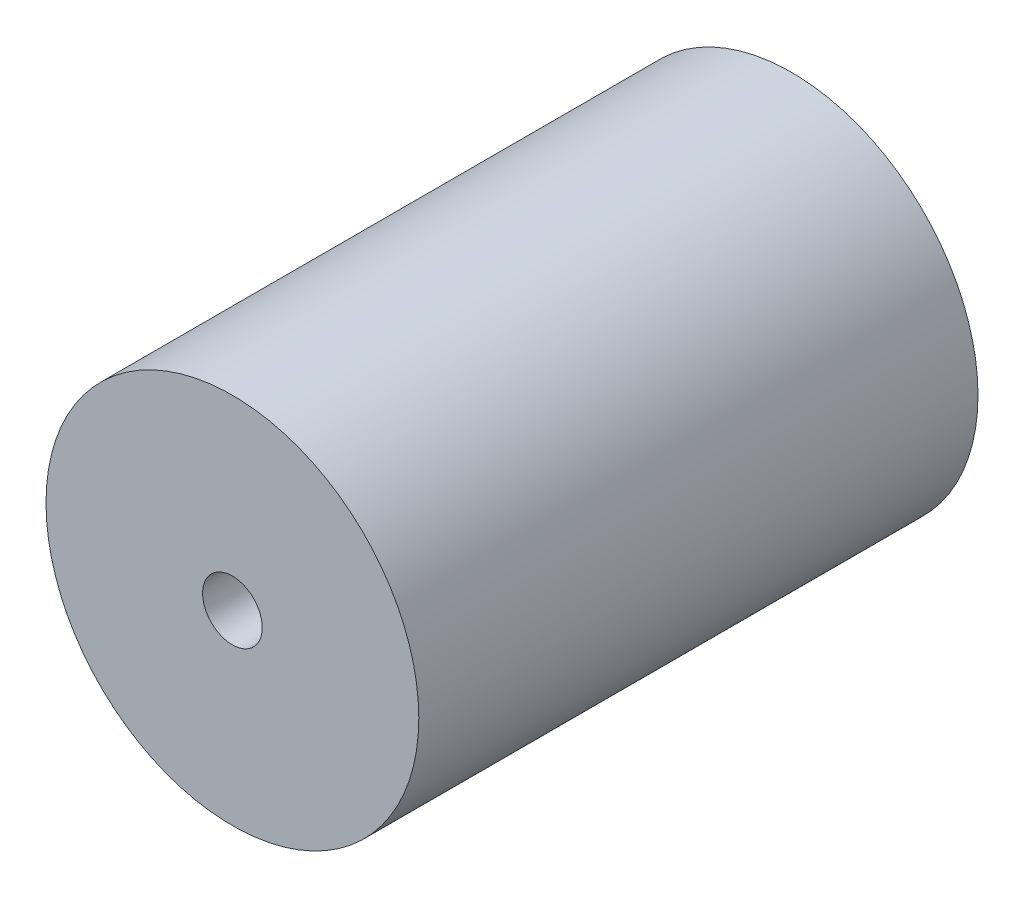
from build123d import *

# Parameters (mm, degrees)
SKETCH_1_R          = 25
EXTRUDE_1_DEPTH     = 100
SKETCH_3_R          = 4
CUT_EXTRUDE_1_DEPTH = 8
SKETCH_4_R          = 25
CUT_EXTRUDE_2_DEPTH = 25


with BuildPart() as part:
    # 草图1 → 凸台-拉伸1 (new body)
    with BuildSketch(Plane.XY):
        Circle(SKETCH_1_R)
    extrude(amount=EXTRUDE_1_DEPTH)

    # 草图3 → 切除-拉伸1 (cut)
    with BuildSketch(Plane.XY.offset(100)):
        Circle(SKETCH_3_R)
    extrude(amount=-CUT_EXTRUDE_1_DEPTH, mode=Mode.SUBTRACT)

    # 草图4 → 切除-拉伸2 (cut)
    with BuildSketch(Plane(origin=(0, 0, 0), x_dir=(-1, 0, 0), z_dir=(0, 0, -1))):
        Circle(SKETCH_4_R)
    extrude(amount=-CUT_EXTRUDE_2_DEPTH, mode=Mode.SUBTRACT)


solid = part.part
